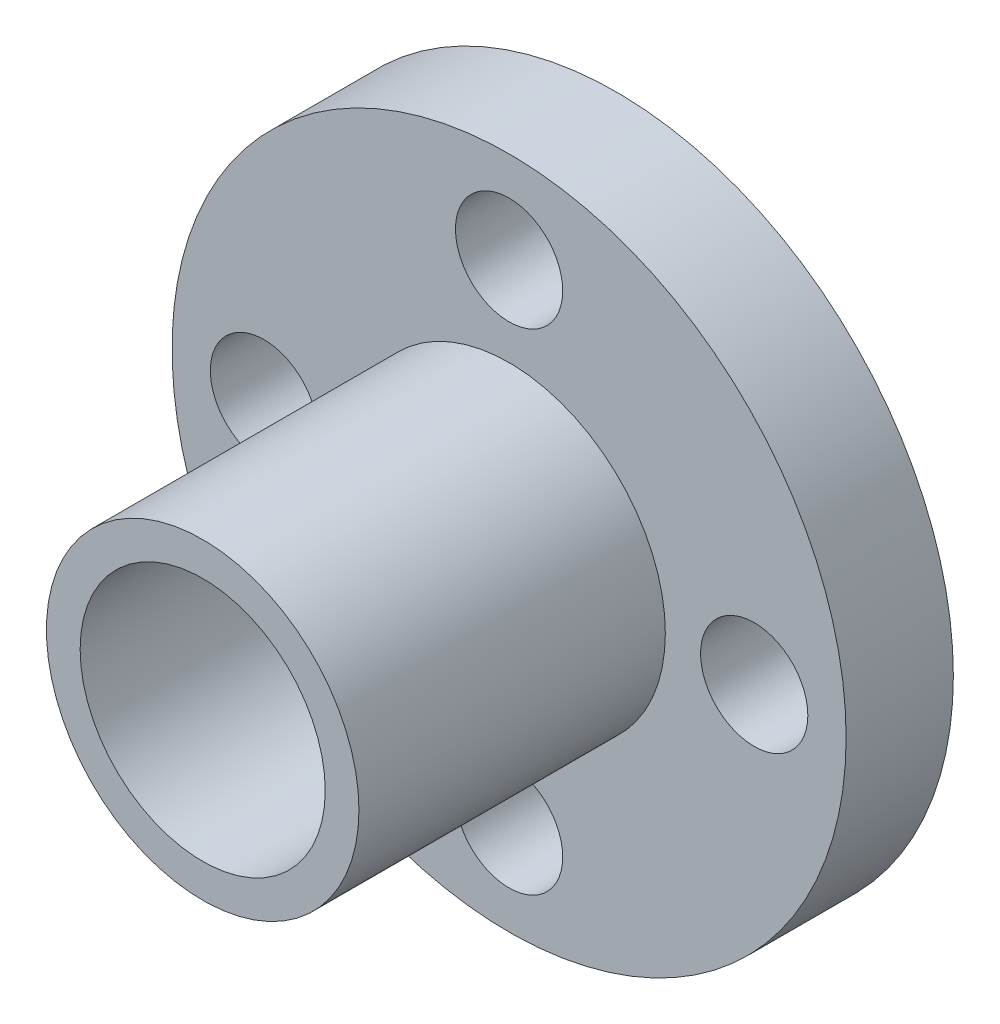
from build123d import *

# Parameters (mm, degrees)
SKETCH_1_R               = 11
EXTRUDE_1_DEPTH          = 3.5
SKETCH_2_R               = 5.1
EXTRUDE_2_DEPTH          = 10
EXTRUDE_START            = 1.5
SKETCH_3_R               = 5.1
EXTRUDE_3_DEPTH          = 1.5
CUT_EXTRUDE_1_DEPTH      = 21.597329924
CUT_EXTRUDE_1_DEPTH_BACK = 21.597329924
SKETCH_4_R               = 1.75
CUT_EXTRUDE_2_DEPTH      = 22.610182785
CUT_EXTRUDE_2_DEPTH_BACK = 22.610182785
SKETCH_5_R               = 4


with BuildPart() as part:
    # 草图1 → 凸台-拉伸1 (new body)
    with BuildSketch(Plane.XY):
        Circle(SKETCH_1_R)
    extrude(amount=EXTRUDE_1_DEPTH)

    # 草图2 → 凸台-拉伸2 (add)
    with BuildSketch(Plane.XY.offset(3.5)):
        Circle(SKETCH_2_R)
    extrude(amount=EXTRUDE_2_DEPTH)

    # 草图3 → 凸台-拉伸3 (add)
    with BuildSketch(Plane(origin=(0, 0, 0), x_dir=(-1, 0, 0), z_dir=(0, 0, -1)).offset(EXTRUDE_START)):
        with Locations(Location((0, 0, 0), (0, 0, 180))):
            Circle(SKETCH_3_R)
    extrude(amount=-EXTRUDE_3_DEPTH)

    # 草图4 → 切除-拉伸1 (cut, two sides: drawn at the far end of the back side and taken through both)
    with BuildSketch(Plane(origin=(0, 0, 0), x_dir=(-1, 0, 0), z_dir=(0, 0, -1)).offset(-CUT_EXTRUDE_1_DEPTH_BACK)):
        with Locations(Location((0, 8, 0), (0, 0, 180))):
            Circle(SKETCH_4_R)
        with Locations(Location((8, 0, 0), (0, 0, 180))):
            Circle(SKETCH_4_R)
        with Locations(Location((0, -8, 0), (0, 0, 180))):
            Circle(SKETCH_4_R)
        with Locations(Location((-8, 0, 0), (0, 0, 180))):
            Circle(SKETCH_4_R)
    extrude(amount=CUT_EXTRUDE_1_DEPTH + CUT_EXTRUDE_1_DEPTH_BACK, mode=Mode.SUBTRACT)

    # 草图5 → 切除-拉伸2 (cut, two sides: drawn at the far end of the back side and taken through both)
    with BuildSketch(Plane(origin=(0, 0, -1.5), x_dir=(-1, 0, 0), z_dir=(0, 0, -1)).offset(-CUT_EXTRUDE_2_DEPTH_BACK)):
        Circle(SKETCH_5_R)
    extrude(amount=CUT_EXTRUDE_2_DEPTH + CUT_EXTRUDE_2_DEPTH_BACK, mode=Mode.SUBTRACT)


solid = part.part
